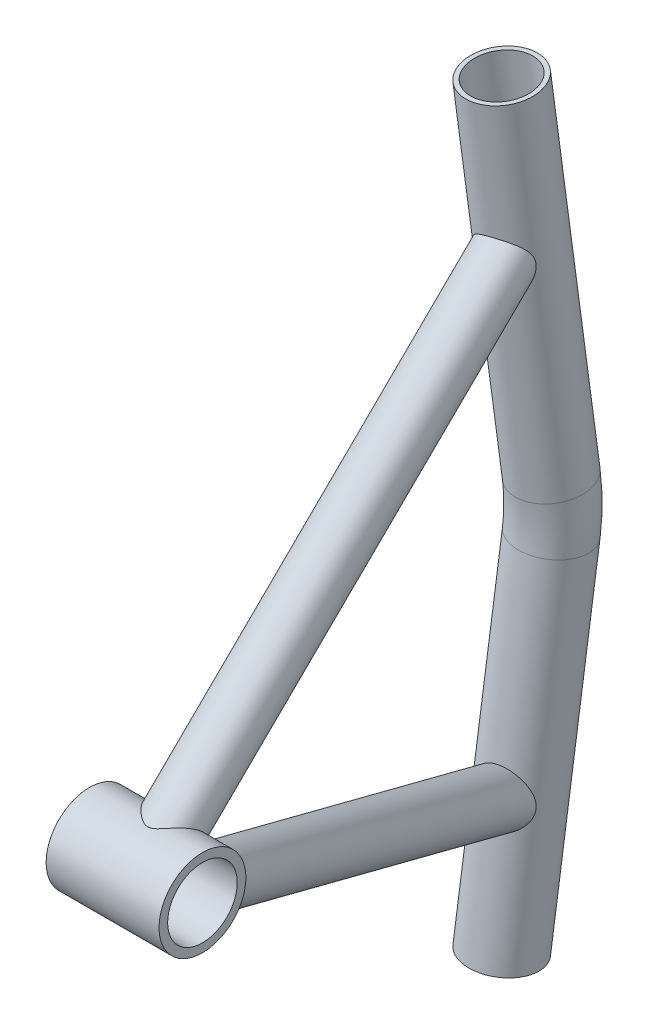
from build123d import *

# Parameters (mm, degrees)
SKETCH6_W                = 41.275
SKETCH6_H                = 3.1496
BOSS_EXTRUDE1_REACH      = 236.173
BOSS_EXTRUDE1_END_RADIUS = 15.875
SKETCH10_R               = 9.525
SKETCH10_R_2             = 7.874
BOSS_EXTRUDE2_REACH      = 282.766
BOSS_EXTRUDE2_END_RADIUS = 15.875
SKETCH11_R               = 9.525
SKETCH11_R_2             = 7.874
SKETCH12_R               = 12.7
SKETCH15_R               = 12.7
SKETCH15_R_2             = 11.049


with BuildPart() as part:
    # Sketch6 → Revolve2 (revolve)
    with BuildSketch(Plane(origin=(0, 0, 0), x_dir=(1, 0, 0), z_dir=(0, 1, 0)), mode=Mode.PRIVATE) as revolve2_sk:
        with Locations((0, 14.3002)):
            Rectangle(SKETCH6_W, SKETCH6_H)
    revolve(revolve2_sk.sketch.rotate(Axis((-66.78681796, 0, 0), (1, 0, 0)), 180), axis=Axis((-66.78681796, 0, 0), (1, 0, 0)))


with BuildPart() as body_2:
    # Boss-Extrude1: up to this cylinder (the profile starts outside it)
    boss_extrude1_end = Plane(origin=(-45.678868, 0, 0), z_dir=(-1, 0, 0)) * Cylinder(BOSS_EXTRUDE1_END_RADIUS, 505.096, mode=Mode.PRIVATE)
    # Sketch10 → Boss-Extrude1 (new, up to the surface)
    with BuildSketch(Plane(origin=(-45.678868166, 89.236316096, -182.596530613), x_dir=(-0.9718118422845564, -0.09767658435659733, 0.21457173174471317), z_dir=(-0.23575780622388015, 0.40263040665345673, -0.8844812109042088)), mode=Mode.PRIVATE) as boss_extrude1_sk1:
        with Locations(Location((0, 0, 0), (0, 0, 90))):
            Circle(SKETCH10_R)
        with Locations(Location((0, 0, 0), (0, 0, 90))):
            Circle(SKETCH10_R_2, mode=Mode.SUBTRACT)
    boss_extrude1_tool1 = extrude(boss_extrude1_sk1.sketch, amount=-BOSS_EXTRUDE1_REACH, mode=Mode.PRIVATE) - boss_extrude1_end
    add(boss_extrude1_tool1.solids().sort_by_distance((-45.678868, 80.812466, -186.431206))[0])


with BuildPart() as body_3:
    # Boss-Extrude2: up to this cylinder (the profile starts outside it)
    boss_extrude2_end = Plane(origin=(-45.678868, 0, 0), z_dir=(-1, 0, 0)) * Cylinder(BOSS_EXTRUDE2_END_RADIUS, 598.282, mode=Mode.PRIVATE)
    # Sketch11 → Boss-Extrude2 (new, up to the surface)
    with BuildSketch(Plane(origin=(-45.678868166, -89.236316096, -182.596530613), x_dir=(-0.9718118422845564, 0.09767658435659739, 0.21457173174471303), z_dir=(-0.23575780622388004, -0.40263040665345723, -0.8844812109042086)), mode=Mode.PRIVATE) as boss_extrude2_sk1:
        with Locations(Location((0, 0, 0), (0, 0, 90))):
            Circle(SKETCH11_R)
        with Locations(Location((0, 0, 0), (0, 0, 90))):
            Circle(SKETCH11_R_2, mode=Mode.SUBTRACT)
    boss_extrude2_tool1 = extrude(boss_extrude2_sk1.sketch, amount=-BOSS_EXTRUDE2_REACH, mode=Mode.PRIVATE) - boss_extrude2_end
    add(boss_extrude2_tool1.solids().sort_by_distance((-45.678868, -97.660166, -178.761855))[0])


with BuildPart() as cut_sweep1_tool:
    # Cut-Sweep1: sweep along a curve in space
    with BuildLine() as cut_sweep1_path:
        Line((-47.937055144, 138.471469808, -177.943551359), (-42.011992023, 9.287572997, -190.152104526))
        ThreePointArc((-42.011992023, 9.287572997, -190.152104526), (-41.79958754, 0, -190.589762549), (-42.011992023, -9.287572997, -190.152104526))
        Line((-42.011992023, -9.287572997, -190.152104526), (-47.937055144, -138.471469808, -177.943551359))
    # Sketch12 → Cut-Sweep1 (sweep)
    with BuildSketch(Plane(origin=(-47.937055144, -138.471469808, -177.943551359), x_dir=(-0.9989591236170096, 0.045412012617268314, -0.004291672446182792), z_dir=(-0.045614354564503724, -0.9945278138635109, 0.09398807429418847))):
        Circle(SKETCH12_R)
    sweep(path=cut_sweep1_path.line)


with BuildPart() as body_2_1:
    add(body_2.part)

    # Cut-Sweep1: cut by cut_sweep1_tool
    add(cut_sweep1_tool.part, mode=Mode.SUBTRACT)


with BuildPart() as body_3_1:
    add(body_3.part)

    # Cut-Sweep1: cut by cut_sweep1_tool
    add(cut_sweep1_tool.part, mode=Mode.SUBTRACT)


with BuildPart() as body_4:
    # Sweep2: sweep along a path in Sketch14
    with BuildLine(Plane(origin=(-108.695110163, 0, -52.751982968), x_dir=(0.43661741575798063, 0, -0.8996472821371844), z_dir=(0.8996472821371844, 0, 0.43661741575798063))) as sweep2_path:
        Line((139.156279218, 138.471469808), (152.726656641, 9.287572997))
        ThreePointArc((152.726656641, 9.287572997), (153.213133989, 0), (152.726656641, -9.287572997))
        Line((152.726656641, -9.287572997), (139.156279218, -138.471469808))
    # Sketch15 → Sweep2 (sweep)
    with BuildSketch(Plane(origin=(-47.937055144, -138.471469808, -177.943551359), x_dir=(-0.9989591236170096, 0.045412012617268314, -0.004291672446182792), z_dir=(-0.045614354564503724, -0.9945278138635109, 0.09398807429418847))):
        Circle(SKETCH15_R)
        Circle(SKETCH15_R_2, mode=Mode.SUBTRACT)
    sweep(path=sweep2_path.line)


solid = Compound([part.part, body_2_1.part, body_3_1.part, body_4.part])
